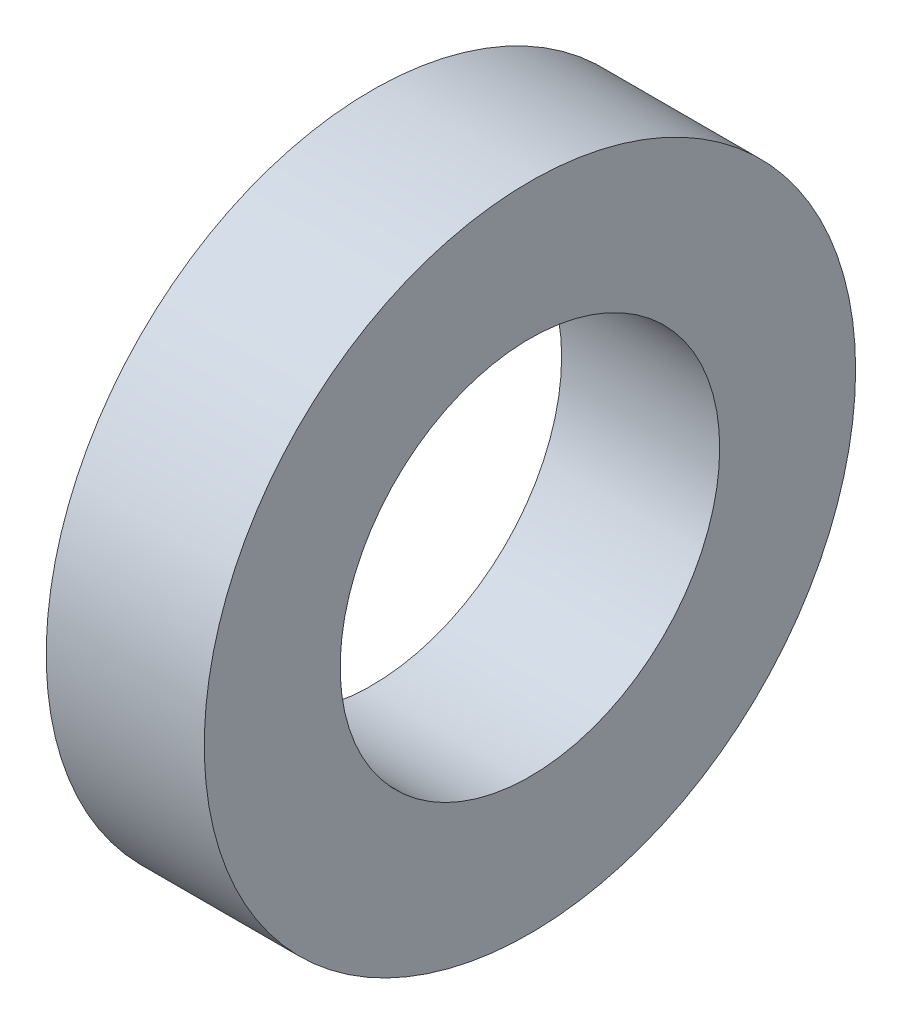
from build123d import *

# Parameters (mm, degrees)
SKETCH1_R           = 9.525
SKETCH1_R_2         = 5.550061314
BOSS_EXTRUDE1_DEPTH = 4.6228


with BuildPart() as part:
    # Sketch1 → Boss-Extrude1 (new body)
    with BuildSketch(Plane(origin=(0, 0, 0), x_dir=(0, 0, -1), z_dir=(1, 0, 0))):
        Circle(SKETCH1_R)
        Circle(SKETCH1_R_2, mode=Mode.SUBTRACT)
    extrude(amount=BOSS_EXTRUDE1_DEPTH)


solid = part.part
